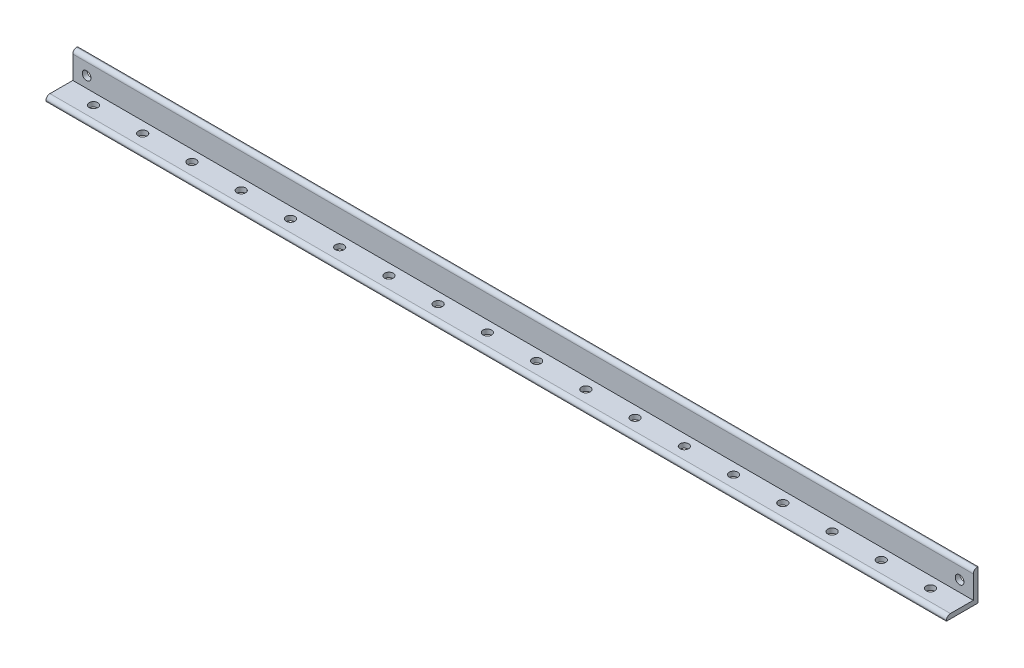
from build123d import *

# Parameters (mm, degrees)
SKETCH_1_W             = 2286
SKETCH_1_H             = 80
EXTRUDE_1_DEPTH        = 80
SKETCH_3_W             = 68
SKETCH_3_H             = 68
CUT_EXTRUDE_2_DEPTH    = 2289.797937783
FILLET_1_R             = 10
SKETCH_4_R             = 11
CUT_EXTRUDE_3_DEPTH    = 2289.797937783
PATTERN_LINEAR_1_COUNT = 2
PATTERN_LINEAR_1_PITCH = 2216.176888
SKETCH_5_R             = 11
CUT_EXTRUDE_4_DEPTH    = 2289.797937783
PATTERN_LINEAR_2_COUNT = 18
PATTERN_LINEAR_2_PITCH = 125


with BuildPart() as part:
    # 草图1 → 拉伸1 (new body)
    with BuildSketch(Plane.XY):
        with Locations((1143, 40)):
            Rectangle(SKETCH_1_W, SKETCH_1_H)
    extrude(amount=EXTRUDE_1_DEPTH)

    # 草图3 → 拉伸2 (cut, through all)
    with BuildSketch(Plane.ZY):
        with Locations((46, 46)):
            Rectangle(SKETCH_3_W, SKETCH_3_H)
    extrude(amount=-CUT_EXTRUDE_2_DEPTH, mode=Mode.SUBTRACT)

    # 圆角1
    fillet_1_edges = [part.edges().sort_by_distance(p)[0] for p in [
        (1143, 80, 12),
        (1143, 12, 80),
    ]]
    fillet(fillet_1_edges, radius=FILLET_1_R)

    # 草图4 → 拉伸3 (cut, through all)
    with BuildSketch(Plane(origin=(0, 0, 0), x_dir=(-1, 0, 0), z_dir=(0, 0, -1))):
        with Locations((-2251.25, 40)):
            Circle(SKETCH_4_R)
    cut_extrude_3 = extrude(amount=-CUT_EXTRUDE_3_DEPTH, mode=Mode.SUBTRACT)

    # 阵列(线性)1: 拉伸3 ×2
    with Locations(*[(-i * PATTERN_LINEAR_1_PITCH, 0, 0) for i in range(1, PATTERN_LINEAR_1_COUNT)]):
        add(cut_extrude_3, mode=Mode.SUBTRACT)

    # 草图5 → 拉伸4 (cut, through all)
    with BuildSketch(Plane.XZ):
        with Locations(Location((80.5, 40, 0), (0, 0, 270))):
            Circle(SKETCH_5_R)
    cut_extrude_4 = extrude(amount=-CUT_EXTRUDE_4_DEPTH, mode=Mode.SUBTRACT)

    # 阵列(线性)2: 拉伸4 ×18
    with Locations(*[(i * PATTERN_LINEAR_2_PITCH, 0, 0) for i in range(1, PATTERN_LINEAR_2_COUNT)]):
        add(cut_extrude_4, mode=Mode.SUBTRACT)


solid = part.part
